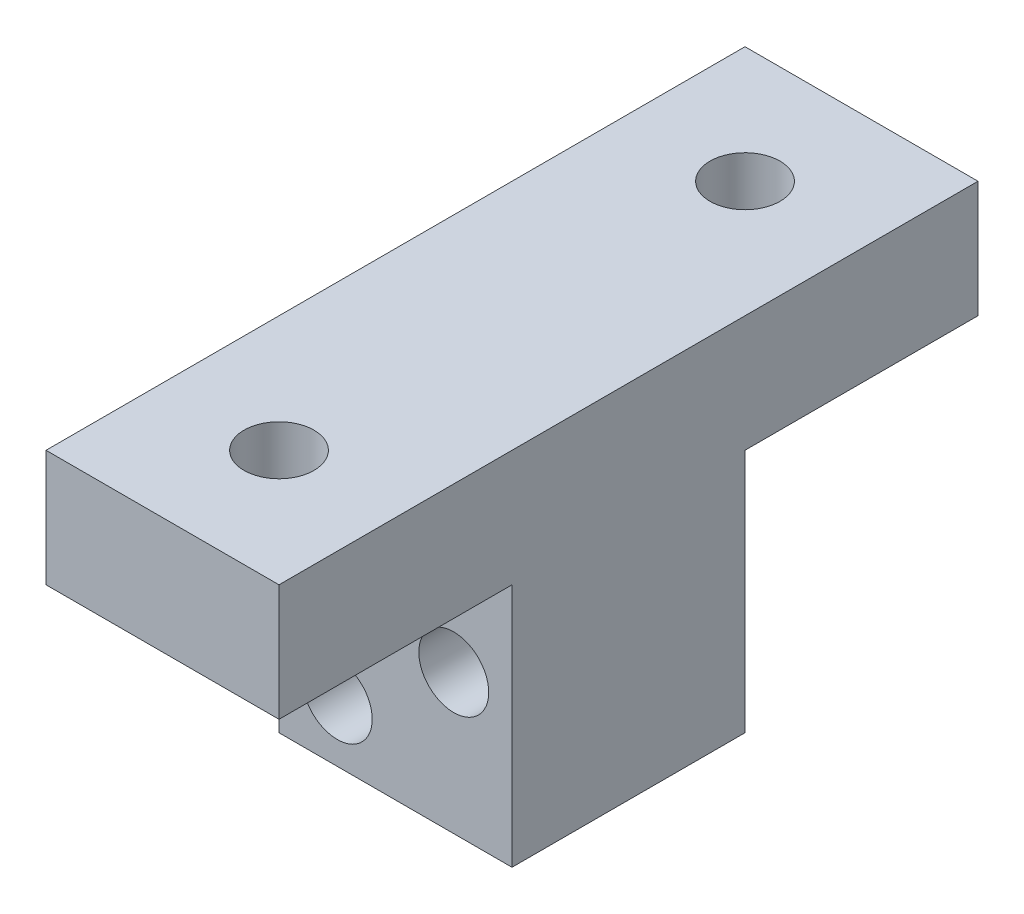
from build123d import *

# Parameters (mm, degrees)
SKETCH_1_W          = 10
SKETCH_1_H          = 15.5
EXTRUDE_1_DEPTH     = 10
SKETCH_2_W          = 10
SKETCH_2_H          = 10
EXTRUDE_2_DEPTH     = 5
SKETCH_3_R          = 1.5
CUT_EXTRUDE_1_DEPTH = 5
SKETCH_4_R          = 1.5
CUT_EXTRUDE_2_DEPTH = 10


with BuildPart() as part:
    # 草图1 → 凸台-拉伸1 (new body)
    with BuildSketch(Plane.XY):
        Rectangle(SKETCH_1_W, SKETCH_1_H)
    extrude(amount=EXTRUDE_1_DEPTH)

    # 草图2 → 凸台-拉伸2 (add)
    with BuildSketch(Plane(origin=(0, 7.75, 0), x_dir=(1, 0, 0), z_dir=(0, 1, 0))):
        with Locations((0, -15)):
            Rectangle(SKETCH_2_W, SKETCH_2_H)
        with Locations((0, 5)):
            Rectangle(SKETCH_2_W, SKETCH_2_H)
    extrude(amount=-EXTRUDE_2_DEPTH)

    # 草图3 → 切除-拉伸1 (cut)
    with BuildSketch(Plane.XZ.offset(-2.75)):
        with Locations(Location((0, -5, 0), (0, 0, 270))):
            Circle(SKETCH_3_R)
        with Locations(Location((0, 15, 0), (0, 0, 270))):
            Circle(SKETCH_3_R)
    extrude(amount=-CUT_EXTRUDE_1_DEPTH, mode=Mode.SUBTRACT)

    # 草图4 → 切除-拉伸2 (cut)
    with BuildSketch(Plane.XY.offset(10)):
        with Locations((-2.5, -5.25)):
            Circle(SKETCH_4_R)
        with Locations((2.5, -1.75)):
            Circle(SKETCH_4_R)
    extrude(amount=-CUT_EXTRUDE_2_DEPTH, mode=Mode.SUBTRACT)


solid = part.part
